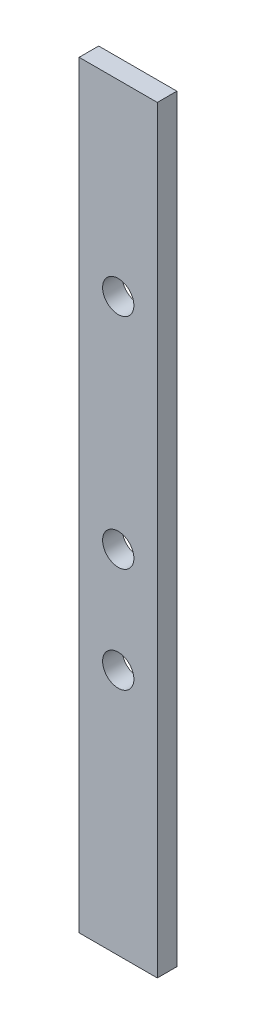
from build123d import *

# Parameters (mm, degrees)
SKETCH2_W           = 12.7
SKETCH2_H           = 3.175
BOSS_EXTRUDE1_DEPTH = 123.19
SKETCH3_R           = 2.54
CUT_EXTRUDE1_DEPTH  = 25.4


with BuildPart() as part:
    # Sketch2 → Boss-Extrude1 (new body)
    with BuildSketch(Plane(origin=(0, 0, 0), x_dir=(1, 0, 0), z_dir=(0, 1, 0))):
        with Locations((6.35, 1.5875)):
            Rectangle(SKETCH2_W, SKETCH2_H)
    extrude(amount=BOSS_EXTRUDE1_DEPTH)

    # Sketch3 → Cut-Extrude1 (cut)
    with BuildSketch(Plane.XY):
        with Locations((6.35, 92.71)):
            Circle(SKETCH3_R)
        with Locations((6.35, 57.15)):
            Circle(SKETCH3_R)
        with Locations((6.35, 40.132)):
            Circle(SKETCH3_R)
    extrude(amount=-CUT_EXTRUDE1_DEPTH, mode=Mode.SUBTRACT)


solid = part.part
